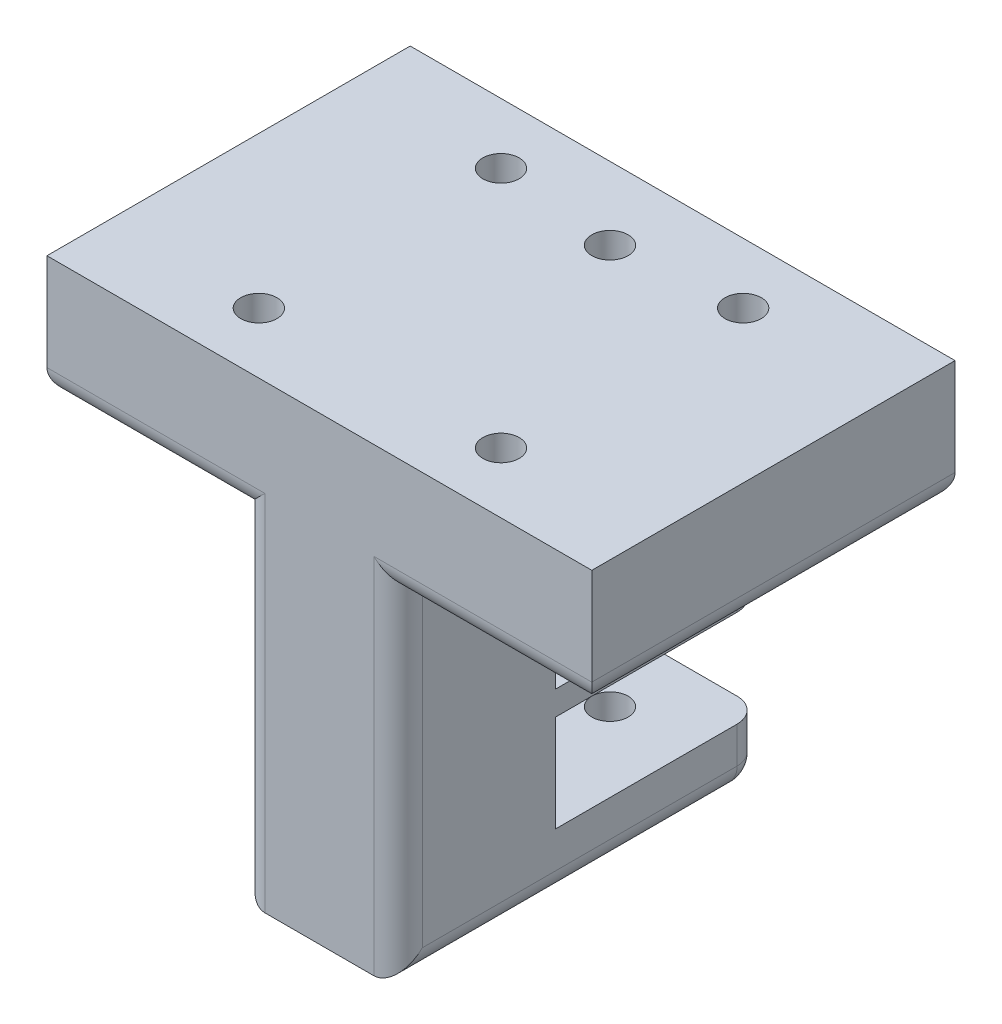
from build123d import *

# Parameters (mm, degrees)
SKETCH1_W           = 45
SKETCH1_H           = 30
SKETCH1_R           = 1.5
BOSS_EXTRUDE1_DEPTH = 10
SKETCH5_W           = 13
SKETCH5_H           = 30
BOSS_EXTRUDE2_DEPTH = 28
SKETCH7_W           = 13
SKETCH7_H           = 8
CUT_EXTRUDE1_DEPTH  = 17
SKETCH8_R           = 1.5
CUT_EXTRUDE2_DEPTH  = 48.697863598
FILLET1_R           = 2


with BuildPart() as part:
    # Sketch1 → Boss-Extrude1 (new body)
    with BuildSketch(Plane(origin=(0, 0, 0), x_dir=(1, 0, 0), z_dir=(0, 1, 0))):
        with Locations((2.00430517, -0.186349789)):
            Rectangle(SKETCH1_W, SKETCH1_H)
        with Locations(Location((-7.99569483, 9.813650211, 0), (0, 0, 270))):
            Circle(SKETCH1_R, mode=Mode.SUBTRACT)
        with Locations(Location((12.00430517, 9.813650211, 0), (0, 0, 270))):
            Circle(SKETCH1_R, mode=Mode.SUBTRACT)
        with Locations(Location((12.00430517, -10.186349789, 0), (0, 0, 270))):
            Circle(SKETCH1_R, mode=Mode.SUBTRACT)
        with Locations(Location((-7.99569483, -10.186349789, 0), (0, 0, 270))):
            Circle(SKETCH1_R, mode=Mode.SUBTRACT)
    extrude(amount=-BOSS_EXTRUDE1_DEPTH)

    # Sketch5 → Boss-Extrude2 (add)
    with BuildSketch(Plane.XZ.offset(10)):
        with Locations((2.00430517, 0.186349789)):
            Rectangle(SKETCH5_W, SKETCH5_H)
    extrude(amount=BOSS_EXTRUDE2_DEPTH)

    # Sketch7 → Cut-Extrude1 (cut)
    with BuildSketch(Plane(origin=(0, 0, -14.813650211), x_dir=(-1, 0, 0), z_dir=(0, 0, -1))):
        with Locations((-2.00430517, -29)):
            Rectangle(SKETCH7_W, SKETCH7_H)
        with Locations((-2.00430517, -19)):
            Rectangle(SKETCH7_W, SKETCH7_H)
    extrude(amount=-CUT_EXTRUDE1_DEPTH, mode=Mode.SUBTRACT)

    # Sketch8 → Cut-Extrude2 (cut, through all)
    with BuildSketch(Plane.XZ.offset(38)):
        with Locations(Location((2.00430517, -8.813650211, 0), (0, 0, 270))):
            Circle(SKETCH8_R)
    extrude(amount=-CUT_EXTRUDE2_DEPTH, mode=Mode.SUBTRACT)

    # Fillet1
    fillet1_edges = [part.edges().sort_by_distance(p)[0] for p in [
        (16.50430517, -10, 15.186349789),
        (16.50430517, -10, -14.813650211),
        (24.50430517, -10, 0.186349789),
        (-4.49569483, -24, 15.186349789),
        (-4.49569483, -35.5, -14.813650211),
        (8.50430517, -35.5, -14.813650211),
        (8.50430517, -24, 15.186349789),
        (-4.49569483, -38, 0.186349789),
        (2.00430517, -38, -14.813650211),
        (8.50430517, -38, 0.186349789),
        (-12.49569483, -10, -14.813650211),
        (-20.49569483, -10, 0.186349789),
        (8.50430517, -24, -14.813650211),
        (8.50430517, -12.5, -14.813650211),
        (-12.49569483, -10, 15.186349789),
        (-4.49569483, -24, -14.813650211),
        (-4.49569483, -12.5, -14.813650211),
    ]]
    fillet(fillet1_edges, radius=FILLET1_R)


solid = part.part
